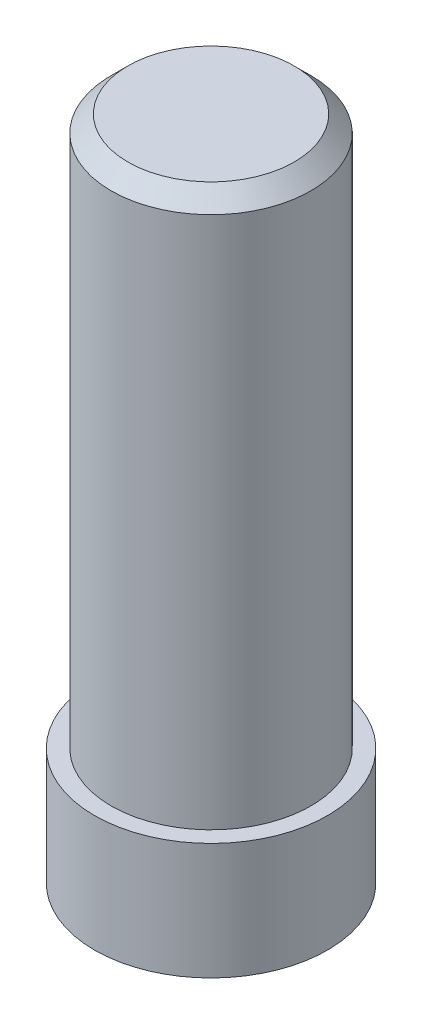
from build123d import *

# Parameters (mm, degrees)
SKETCH_1_R      = 7
EXTRUDE_1_DEPTH = 7
EXTRUDE_START   = 7
SKETCH_2_R      = 6
EXTRUDE_2_DEPTH = 33


with BuildPart() as part:
    # 草图1 → 凸台-拉伸1 (new body)
    with BuildSketch(Plane(origin=(0, 0, 0), x_dir=(1, 0, 0), z_dir=(0, 1, 0))):
        with Locations(Location((0, 0, 0), (0, 0, 270))):
            Circle(SKETCH_1_R)
    extrude(amount=EXTRUDE_1_DEPTH)

    # 草图2 → 凸台-拉伸2 (add)
    with BuildSketch(Plane(origin=(0, 0, 0), x_dir=(1, 0, 0), z_dir=(0, 1, 0)).offset(EXTRUDE_START)):
        with Locations(Location((0, 0, 0), (0, 0, 270))):
            Circle(SKETCH_2_R)
    extrude(amount=EXTRUDE_2_DEPTH)

    # 草图3 → 切除-旋转1 (revolve, cut)
    with BuildSketch(Plane.XY, mode=Mode.PRIVATE) as cut_revolve_1_sk:
        Polygon((6, 40), (5, 40), (6, 39), align=None)
    revolve(cut_revolve_1_sk.sketch.rotate(Axis((0, 40, 0), (0, -1, 0)), 90), axis=Axis((0, 40, 0), (0, -1, 0)), mode=Mode.SUBTRACT)


solid = part.part
